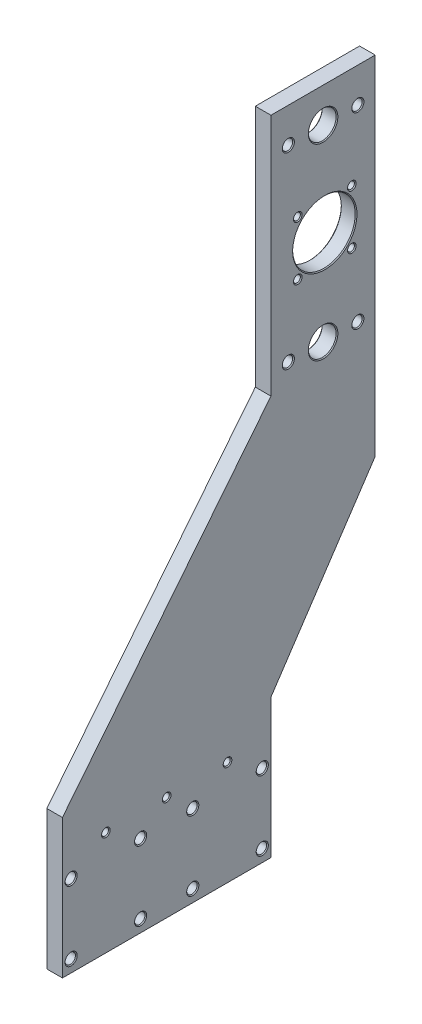
from build123d import *

# Parameters (mm, degrees)
SALIENTE_EXTRUIR1_DEPTH = 4.5
CROQUIS4_R              = 18
CROQUIS4_R_2            = 2
CORTAR_EXTRUIR3_DEPTH   = 599.217436148
CHAFL_N1_SIZE           = 0.5
CROQUIS5_R              = 8
CROQUIS5_R_2            = 3
CORTAR_EXTRUIR4_DEPTH   = 599.217436148
CHAFL_N2_SIZE           = 0.5
CROQUIS3_R              = 3
CORTAR_EXTRUIR2_DEPTH   = 599.217436148
CHAFL_N3_SIZE           = 0.5
CROQUIS2_R              = 2
CORTAR_EXTRUIR1_DEPTH   = 599.217436148
CHAFL_N4_SIZE           = 0.5
CHAFL_N5_SIZE           = 0.5


with BuildPart() as part:
    # Croquis1 → Saliente-Extruir1 (new, symmetric)
    with BuildSketch(Plane(origin=(0, 0, 0), x_dir=(0, 0, -1), z_dir=(1, 0, 0))):
        Polygon((-294.796624044, -440.459461787), (-174.796624044, -290.459461787), (-174.796624044, -150.459461787), (-114.796624044, -150.459461787), (-114.796624044, -350.459461787), (-174.796624044, -440.459461787), (-174.796624044, -520.459461787), (-294.796624044, -520.459461787), align=None)
    extrude(amount=SALIENTE_EXTRUIR1_DEPTH, both=True)

    # Croquis4 → Cortar-Extruir3 (cut, through all)
    with BuildSketch(Plane(origin=(4.5, 0, 0), x_dir=(0, 0, -1), z_dir=(1, 0, 0))):
        with Locations((-143.796624044, -224.459461787)):
            Circle(CROQUIS4_R)
        with Locations((-159.35297323, -208.903112601)):
            Circle(CROQUIS4_R_2)
        with Locations((-128.240274858, -208.903112601)):
            Circle(CROQUIS4_R_2)
        with Locations((-128.240274858, -240.015810973)):
            Circle(CROQUIS4_R_2)
        with Locations((-159.35297323, -240.015810973)):
            Circle(CROQUIS4_R_2)
    extrude(amount=-CORTAR_EXTRUIR3_DEPTH, mode=Mode.SUBTRACT)

    # Chaflán1
    chafl_n1_edges = [part.edges().sort_by_distance(p)[0] for p in [
        (4.5, -224.459461787, 161.796624044),
        (4.5, -208.903112601, 161.35297323),
        (4.5, -208.903112601, 130.240274858),
        (4.5, -240.015810973, 130.240274858),
        (4.5, -240.015810973, 161.35297323),
    ]]
    chamfer(chafl_n1_edges, length=CHAFL_N1_SIZE)

    # Croquis5 → Cortar-Extruir4 (cut, through all)
    with BuildSketch(Plane(origin=(4.5, 0, 0), x_dir=(0, 0, -1), z_dir=(1, 0, 0))):
        with Locations((-144.796624044, -170.459461787)):
            Circle(CROQUIS5_R)
        with Locations((-144.796624044, -278.459461787)):
            Circle(CROQUIS5_R)
        with Locations((-124.796624044, -170.459461787)):
            Circle(CROQUIS5_R_2)
        with Locations((-164.796624044, -170.459461787)):
            Circle(CROQUIS5_R_2)
        with Locations((-164.796624044, -278.459461787)):
            Circle(CROQUIS5_R_2)
        with Locations((-124.796624044, -278.459461787)):
            Circle(CROQUIS5_R_2)
    extrude(amount=-CORTAR_EXTRUIR4_DEPTH, mode=Mode.SUBTRACT)

    # Chaflán2
    chafl_n2_edges = [part.edges().sort_by_distance(p)[0] for p in [
        (4.5, -170.459461787, 152.796624044),
        (4.5, -278.459461787, 152.796624044),
        (4.5, -170.459461787, 127.796624044),
        (4.5, -170.459461787, 167.796624044),
        (4.5, -278.459461787, 167.796624044),
        (4.5, -278.459461787, 127.796624044),
    ]]
    chamfer(chafl_n2_edges, length=CHAFL_N2_SIZE)

    # Croquis3 → Cortar-Extruir2 (cut, through all)
    with BuildSketch(Plane(origin=(4.5, 0, 0), x_dir=(0, 0, -1), z_dir=(1, 0, 0))):
        with Locations((-289.796624044, -473.459461787)):
            Circle(CROQUIS3_R)
        with Locations((-289.796624044, -513.459461787)):
            Circle(CROQUIS3_R)
        with Locations((-249.796624044, -473.459461787)):
            Circle(CROQUIS3_R)
        with Locations((-249.796624044, -513.459461787)):
            Circle(CROQUIS3_R)
        with Locations(Location((-219.796624044, -513.459461787, 0), (0, 0, 180))):
            Circle(CROQUIS3_R)
        with Locations(Location((-219.796624044, -473.459461787, 0), (0, 0, 180))):
            Circle(CROQUIS3_R)
        with Locations(Location((-179.796624044, -513.459461787, 0), (0, 0, 180))):
            Circle(CROQUIS3_R)
        with Locations(Location((-179.796624044, -473.459461787, 0), (0, 0, 180))):
            Circle(CROQUIS3_R)
    extrude(amount=-CORTAR_EXTRUIR2_DEPTH, mode=Mode.SUBTRACT)

    # Chaflán3
    chafl_n3_edges = [part.edges().sort_by_distance(p)[0] for p in [
        (4.5, -473.459461787, 292.796624044),
        (4.5, -513.459461787, 292.796624044),
        (4.5, -473.459461787, 252.796624044),
        (4.5, -513.459461787, 252.796624044),
        (4.5, -513.459461787, 216.796624044),
        (4.5, -473.459461787, 216.796624044),
        (4.5, -513.459461787, 176.796624044),
        (4.5, -473.459461787, 176.796624044),
    ]]
    chamfer(chafl_n3_edges, length=CHAFL_N3_SIZE)

    # Croquis2 → Cortar-Extruir1 (cut, through all)
    with BuildSketch(Plane(origin=(4.5, 0, 0), x_dir=(0, 0, -1), z_dir=(1, 0, 0))):
        with Locations((-234.796624044, -460.459461787)):
            Circle(CROQUIS2_R)
        with Locations((-269.796624044, -460.459461787)):
            Circle(CROQUIS2_R)
        with Locations((-199.796624044, -460.459461787)):
            Circle(CROQUIS2_R)
    extrude(amount=-CORTAR_EXTRUIR1_DEPTH, mode=Mode.SUBTRACT)

    # Chaflán4
    chafl_n4_edges = [part.edges().sort_by_distance(p)[0] for p in [
        (4.5, -460.459461787, 236.796624044),
        (4.5, -460.459461787, 271.796624044),
        (4.5, -460.459461787, 201.796624044),
    ]]
    chamfer(chafl_n4_edges, length=CHAFL_N4_SIZE)

    # Chaflán5
    chafl_n5_edges = [part.edges().sort_by_distance(p)[0] for p in [
        (-4.5, -224.459461787, 161.796624044),
        (-4.5, -170.459461787, 152.796624044),
        (-4.5, -278.459461787, 152.796624044),
    ]]
    chamfer(chafl_n5_edges, length=CHAFL_N5_SIZE)


solid = part.part
